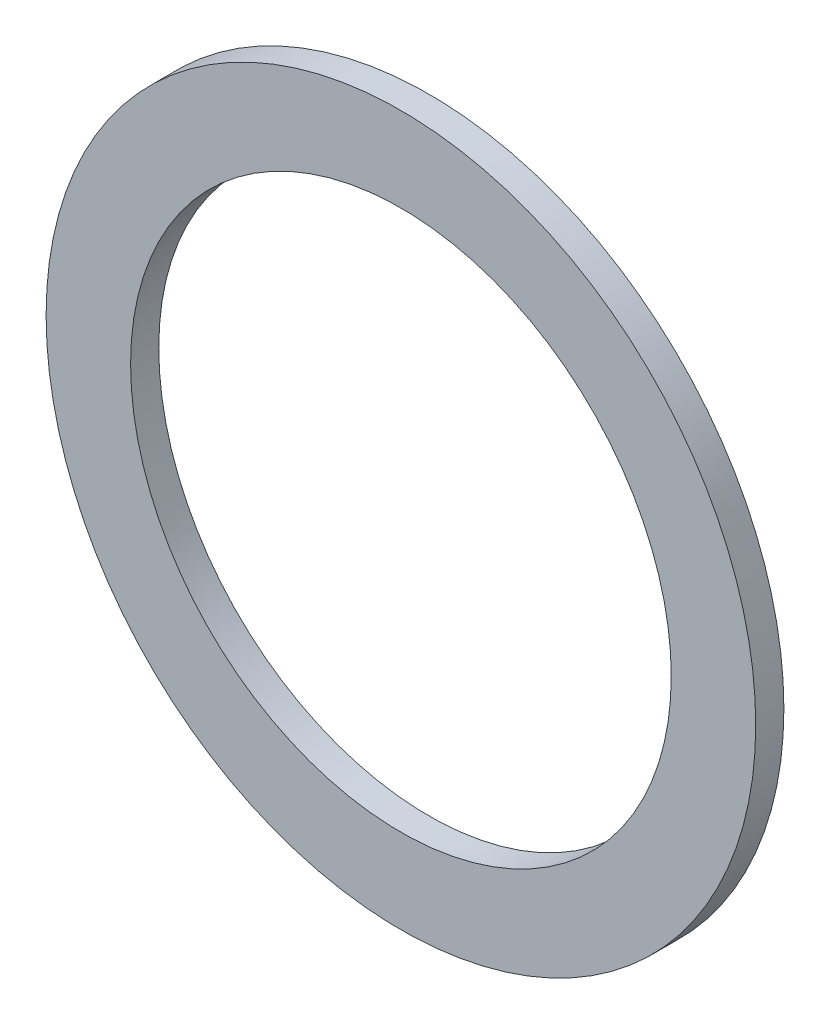
from build123d import *

# Parameters (mm, degrees)
SKETCH_1_R      = 6.3
SKETCH_1_R_2    = 4.8
EXTRUDE_1_DEPTH = 0.5


with BuildPart() as part:
    # Эскиз1 → Вытянуть1 (new body)
    with BuildSketch(Plane.XY):
        Circle(SKETCH_1_R)
        Circle(SKETCH_1_R_2, mode=Mode.SUBTRACT)
    extrude(amount=EXTRUDE_1_DEPTH)


solid = part.part
